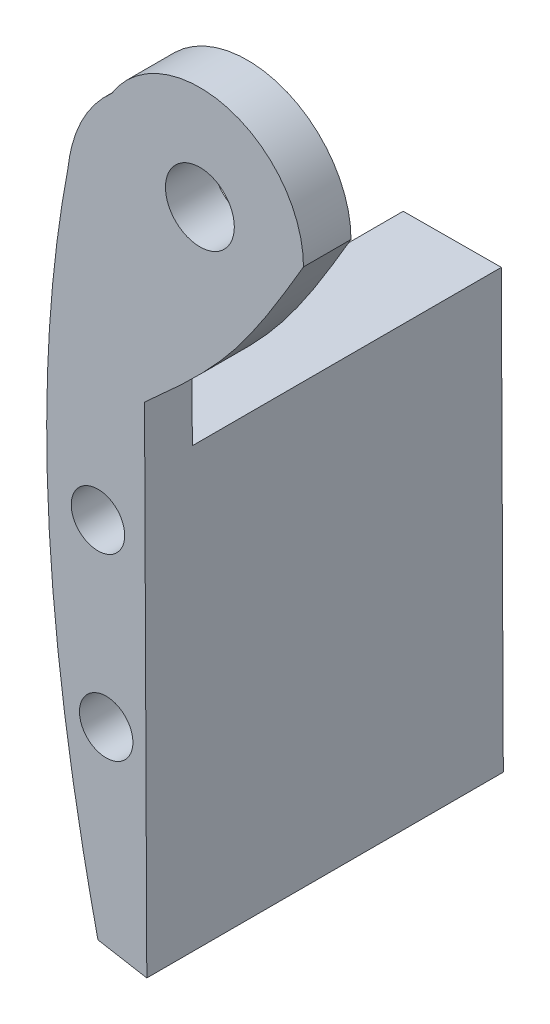
from build123d import *
from build123d.topology import SkipClean

# Parameters (mm, degrees)
SKETCH1_R           = 2.9
BOSS_EXTRUDE1_DEPTH = 4
SKETCH2_R           = 2.25
BOSS_EXTRUDE2_DEPTH = 26.012432
SKETCH3_R           = 2.25
CUT_EXTRUDE1_DEPTH  = 79.761768867


with BuildPart() as part:
    # Sketch1 → Boss-Extrude1 (new body)
    with BuildSketch(Plane.XY):
        with BuildLine():
            Line((-14.153385189, -69.716871134), (-10.039841479, -70.438427685))
            Line((-10.039841479, -70.438427685), (-10.231600818, -28.548135162))
            add(Edge.make_bspline(
                [(3.150526507, -12), (1.121426745, -15.448537633), (-2.522354698, -21.641292501), (-7.864373324, -26.42729642), (-10.231600818, -28.548135162)],
                knots=[0, 0, 0, 0, 0.556866484, 1, 1, 1, 1], degree=3))
            ThreePointArc((3.150526507, -12), (-3.18362895, -3.611112101), (-12.986183722, -7.406488955))
            add(Edge.make_bspline(
                [(-16.663916234, -14.630806425), (-16.157795835, -10.23676377), (-12.986183722, -7.406488955)],
                knots=[0, 0, 0, 1, 1, 1], degree=2))
            add(Edge.make_bspline(
                [(-16.663916234, -14.630806425), (-17.667702323, -19.881251045), (-18.220131563, -25.189037493), (-18.401311599, -30.514562532)],
                knots=[0, 0, 0, 0, 0.288118642, 0.288118642, 0.288118642, 0.288118642], degree=3))
            add(Edge.make_bspline(
                [(-18.401311599, -30.514562532), (-18.848969857, -43.672829442), (-17.03022033, -56.93938717), (-14.153385189, -69.716871134)],
                knots=[0.288118642, 0.288118642, 0.288118642, 0.288118642, 1, 1, 1, 1], degree=3))
        make_face()
        with Locations((-5.571628032, -12)):
            Circle(SKETCH1_R, mode=Mode.SUBTRACT)
    extrude(amount=-BOSS_EXTRUDE1_DEPTH)

    # Sketch2 → Boss-Extrude2 (add)
    with BuildSketch(Plane(origin=(0, 0, -4), x_dir=(-1, 0, 0), z_dir=(0, 0, -1))):
        with BuildLine():
            Line((10.207939206, -33.717071631), (18.466393507, -33.754875992))
            add(Edge.make_bspline(
                [(14.153385189, -69.716871134), (16.794208846, -57.987633874), (18.543433317, -45.846277061), (18.466393507, -33.754875992)],
                knots=[0.288118642, 0.288118642, 0.288118642, 0.288118642, 0.941598261, 0.941598261, 0.941598261, 0.941598261], degree=3))
            Line((14.153385189, -69.716871134), (10.039841479, -70.438427685))
            Line((10.039841479, -70.438427685), (10.207939206, -33.717071631))
        make_face()
        with Locations((14.152153946, -39.103816176)):
            Circle(SKETCH2_R, mode=Mode.SUBTRACT)
    extrude(amount=BOSS_EXTRUDE2_DEPTH)

    # Sketch3 → Cut-Extrude1 (cut, through all)
    with SkipClean():  # the faces are left unmerged after this step: merging them gives an invalid solid
        with BuildSketch(Plane.XY):
            with Locations((-13.459661862, -53.850312066)):
                Circle(SKETCH3_R)
            with Locations((-14.152153946, -39.103816176)):
                Circle(SKETCH3_R)
        extrude(amount=-CUT_EXTRUDE1_DEPTH, mode=Mode.SUBTRACT)


solid = part.part
